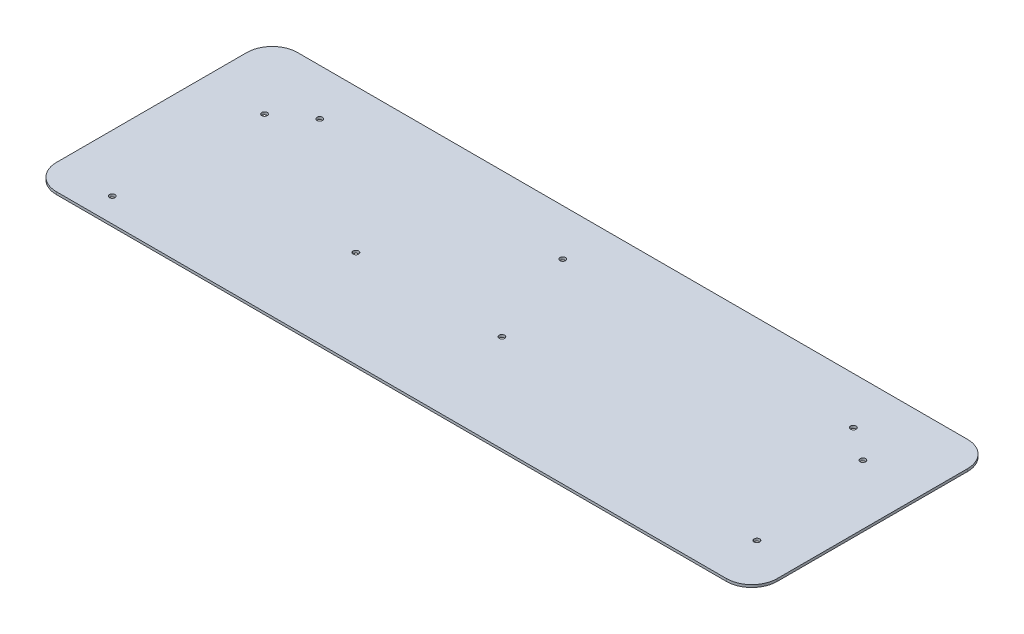
from build123d import *

# Parameters (mm, degrees)
SKETCH3_W             = 284
SKETCH3_H             = 95
BOSS_EXTRUDE1_DEPTH   = 1
F_2_0MM_DOWEL_HOLE1_D = 2.2
FILLET1_R             = 10


with BuildPart() as part:
    # Sketch3 → Boss-Extrude1 (new body)
    with BuildSketch(Plane(origin=(0, 0, 0), x_dir=(1, 0, 0), z_dir=(0, 1, 0))):
        with Locations((165.765656923, 368.514519522)):
            Rectangle(SKETCH3_W, SKETCH3_H)
    extrude(amount=BOSS_EXTRUDE1_DEPTH)

    # Ø2.0mm Dowel Hole1 (through all)
    with Locations(Plane(origin=(0, 1, 0), x_dir=(1, 0, 0), z_dir=(0, 1, 0))):
        with Locations((48.265656923, 388.514519522), (60.765656923, 397.764519522), (46.265656923, 330.514519522), (113.515656923, 359.264519522), (156.515656923, 397.764519522), (171.015656923, 359.264519522), (271.265656923, 397.514519522), (284.265656923, 388.264519522), (290.765656923, 340.014519522)):
            Hole(F_2_0MM_DOWEL_HOLE1_D / 2)

    # Fillet1
    fillet1_edges = [part.edges().sort_by_distance(p)[0] for p in [
        (23.765656923, 0.5, -416.014519522),
        (307.765656923, 0.5, -416.014519522),
        (307.765656923, 0.5, -321.014519522),
        (23.765656923, 0.5, -321.014519522),
    ]]
    fillet(fillet1_edges, radius=FILLET1_R)


solid = part.part
